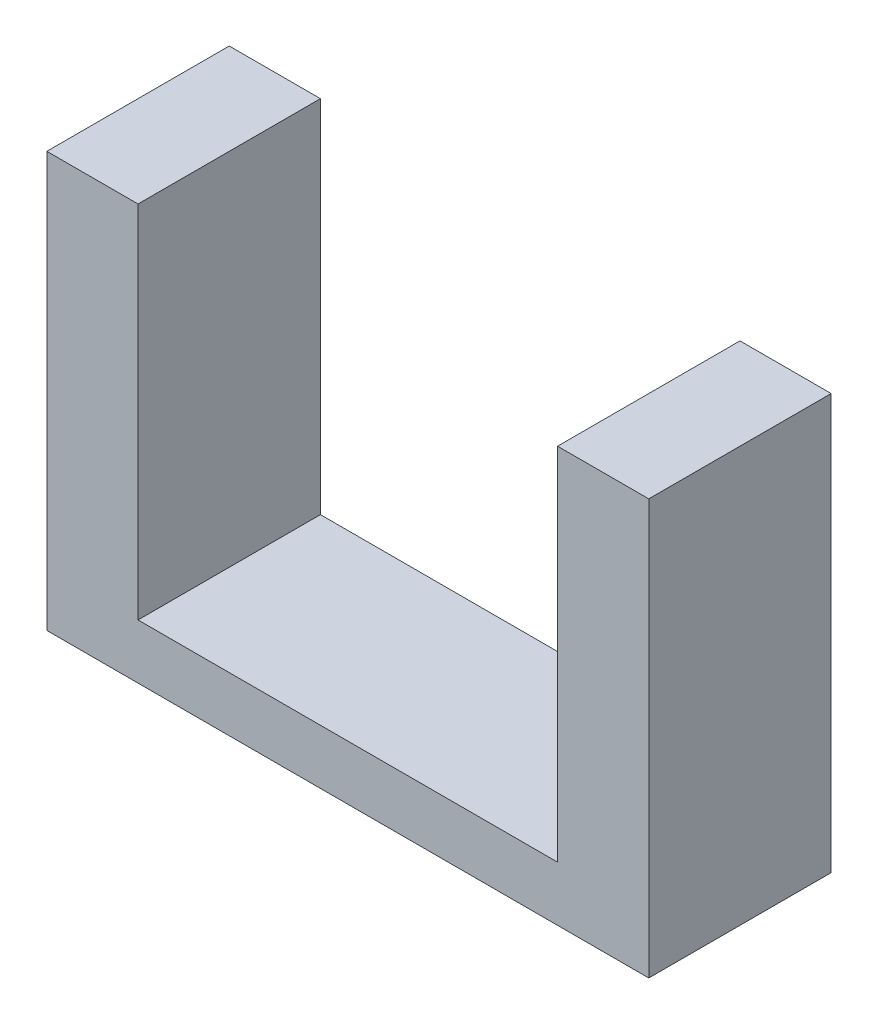
from build123d import *

# Parameters (mm, degrees)
SKETCH1_W           = 23
SKETCH1_H           = 10
BOSS_EXTRUDE1_DEPTH = 3
SKETCH2_W           = 5
SKETCH2_H           = 10
BOSS_EXTRUDE2_DEPTH = 22.75


with BuildPart() as part:
    # Sketch1 → Boss-Extrude1 (new body)
    with BuildSketch(Plane(origin=(0, 0, 0), x_dir=(1, 0, 0), z_dir=(0, 1, 0))):
        Rectangle(SKETCH1_W, SKETCH1_H)
    extrude(amount=BOSS_EXTRUDE1_DEPTH)

    # Sketch2 → Boss-Extrude2 (add)
    with BuildSketch(Plane(origin=(0, 0, 0), x_dir=(1, 0, 0), z_dir=(0, 1, 0))):
        with Locations((14, 0)):
            Rectangle(SKETCH2_W, SKETCH2_H)
        with Locations((-14, 0)):
            Rectangle(SKETCH2_W, SKETCH2_H)
    extrude(amount=BOSS_EXTRUDE2_DEPTH)


solid = part.part
